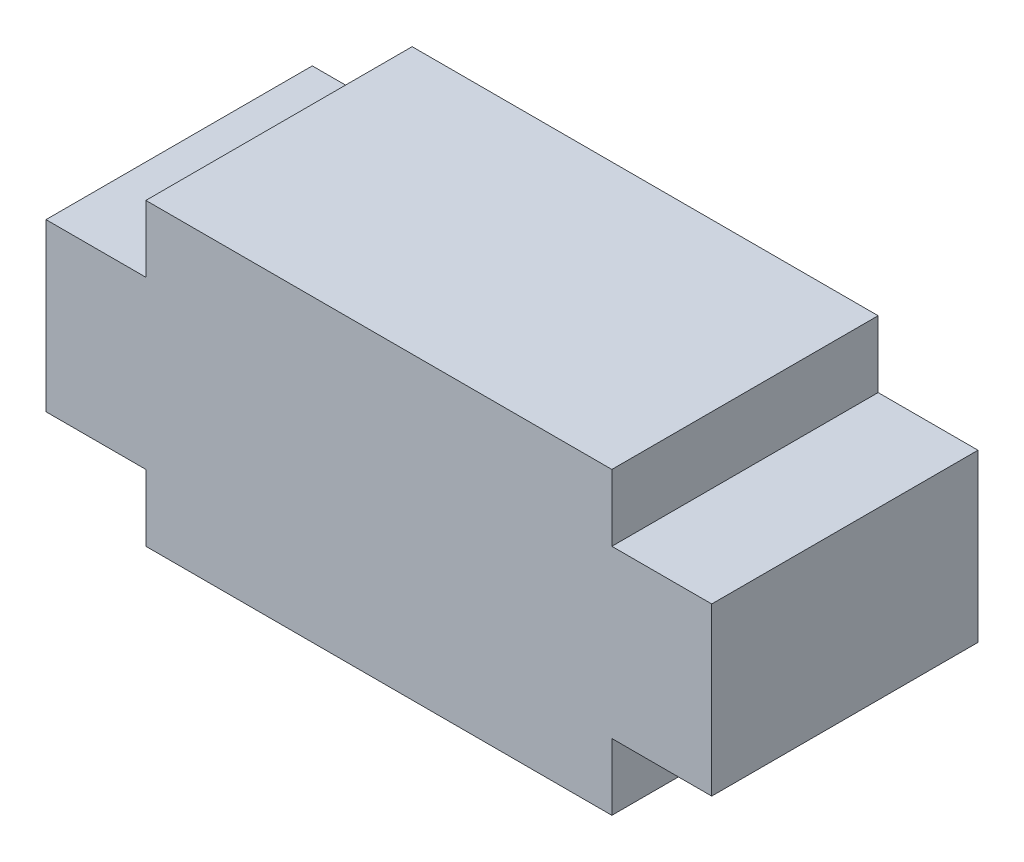
from build123d import *

# Parameters (mm, degrees)
COMPONENT_OUTLINE_DEPTH = 0.8


with BuildPart() as part:
    # 草图1 → Component_Outline (new body)
    with BuildSketch(Plane.XY):
        Polygon((1, -0.25), (0.7, -0.25), (0.7, -0.45), (-0.7, -0.45), (-0.7, -0.25), (-1, -0.25), (-1, 0.25), (-0.7, 0.25), (-0.7, 0.45), (0.7, 0.45), (0.7, 0.25), (1, 0.25), align=None)
    extrude(amount=COMPONENT_OUTLINE_DEPTH)


solid = part.part
